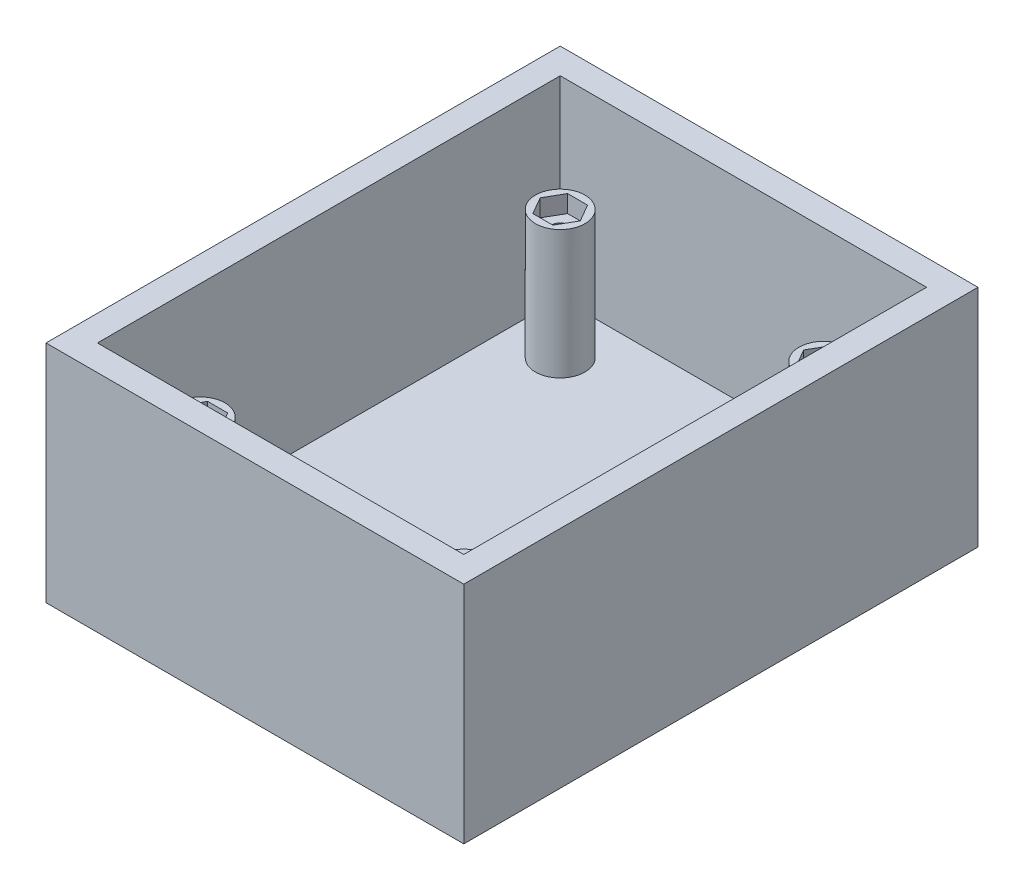
from build123d import *

# Parameters (mm, degrees)
SKETCH1_W                                = 65
SKETCH1_H                                = 80
BOSS_EXTRUDE1_DEPTH                      = 5
SKETCH2_W                                = 65
SKETCH2_H                                = 80
SKETCH2_W_2                              = 57
SKETCH2_H_2                              = 72
BOSS_EXTRUDE2_DEPTH                      = 30
SKETCH3_R                                = 3.85
BOSS_EXTRUDE3_DEPTH                      = 20
TAP_DRILL_FOR_M3_TAP1_D                  = 2.5
TAP_DRILL_FOR_M3_TAP1_DEPTH              = 12
TAP_DRILL_FOR_M3_TAP1_TIP                = 0.751075774
CUT_EXTRUDE1_DEPTH                       = 2.7
MIRROR1_AT_THE_SECOND_PLANE_COPY_1_DEPTH = 2.7


with BuildPart() as part:
    # Sketch1 → Boss-Extrude1 (new body)
    with BuildSketch(Plane(origin=(0, 0, 0), x_dir=(1, 0, 0), z_dir=(0, 1, 0))):
        Rectangle(SKETCH1_W, SKETCH1_H)
    extrude(amount=BOSS_EXTRUDE1_DEPTH)

    # Sketch2 → Boss-Extrude2 (add)
    with BuildSketch(Plane(origin=(0, 5, 0), x_dir=(1, 0, 0), z_dir=(0, 1, 0))):
        Rectangle(SKETCH2_W, SKETCH2_H)
        Rectangle(SKETCH2_W_2, SKETCH2_H_2, mode=Mode.SUBTRACT)
    extrude(amount=BOSS_EXTRUDE2_DEPTH)

    # Sketch3 → Boss-Extrude3 (add)
    with BuildSketch(Plane(origin=(0, 5, 0), x_dir=(1, 0, 0), z_dir=(0, 1, 0))):
        with Locations(Location((-20.5, -28, 0), (0, 0, 90))):
            Circle(SKETCH3_R)
        with Locations(Location((20.5, -28, 0), (0, 0, 90))):
            Circle(SKETCH3_R)
        with Locations(Location((20.5, 28, 0), (0, 0, 90))):
            Circle(SKETCH3_R)
        with Locations(Location((-20.5, 28, 0), (0, 0, 90))):
            Circle(SKETCH3_R)
    extrude(amount=BOSS_EXTRUDE3_DEPTH)

    # Tap Drill for M3 Tap1
    with Locations(Plane(origin=(0, 25, 0), x_dir=(1, 0, 0), z_dir=(0, 1, 0))):
        with Locations((-20.5, 28), (20.5, 28), (20.5, -28), (-20.5, -28)):
            Hole(TAP_DRILL_FOR_M3_TAP1_D / 2, depth=TAP_DRILL_FOR_M3_TAP1_DEPTH)
            with Locations((0, 0, -(TAP_DRILL_FOR_M3_TAP1_DEPTH + TAP_DRILL_FOR_M3_TAP1_TIP / 2))):  # 118° drill point
                Cone(0, TAP_DRILL_FOR_M3_TAP1_D / 2, TAP_DRILL_FOR_M3_TAP1_TIP, mode=Mode.SUBTRACT)

    # Sketch8 → Cut-Extrude1 (cut)
    with BuildSketch(Plane(origin=(0, 25, 0), x_dir=(1, 0, 0), z_dir=(0, 1, 0))):
        Polygon((-17.382308546, 28), (-18.941154273, 30.7), (-22.058845727, 30.7), (-23.617691454, 28), (-22.058845727, 25.3), (-18.941154273, 25.3), align=None)
    cut_extrude1 = extrude(amount=-CUT_EXTRUDE1_DEPTH, mode=Mode.SUBTRACT)

    # Mirror1: Cut-Extrude1 across plane
    add(cut_extrude1.mirror(Plane.XY), mode=Mode.SUBTRACT)

    # Mirror1 at the second plane: Cut-Extrude1 across plane
    add(cut_extrude1.mirror(Plane(origin=(0, 0, 0), x_dir=(0, 0, 1), z_dir=(1, 0, 0))), mode=Mode.SUBTRACT)

    # Mirror1 at the second plane copy 1 sketc → Mirror1 at the second plane copy 1 (cut)
    with BuildSketch(Plane(origin=(0, 25, 0), x_dir=(-1, 0, 0), z_dir=(0, 1, 0))):
        Polygon((-17.382308546, 28), (-18.941154273, 30.7), (-22.058845727, 30.7), (-23.617691454, 28), (-22.058845727, 25.3), (-18.941154273, 25.3), align=None)
    extrude(amount=-MIRROR1_AT_THE_SECOND_PLANE_COPY_1_DEPTH, mode=Mode.SUBTRACT)


solid = part.part
